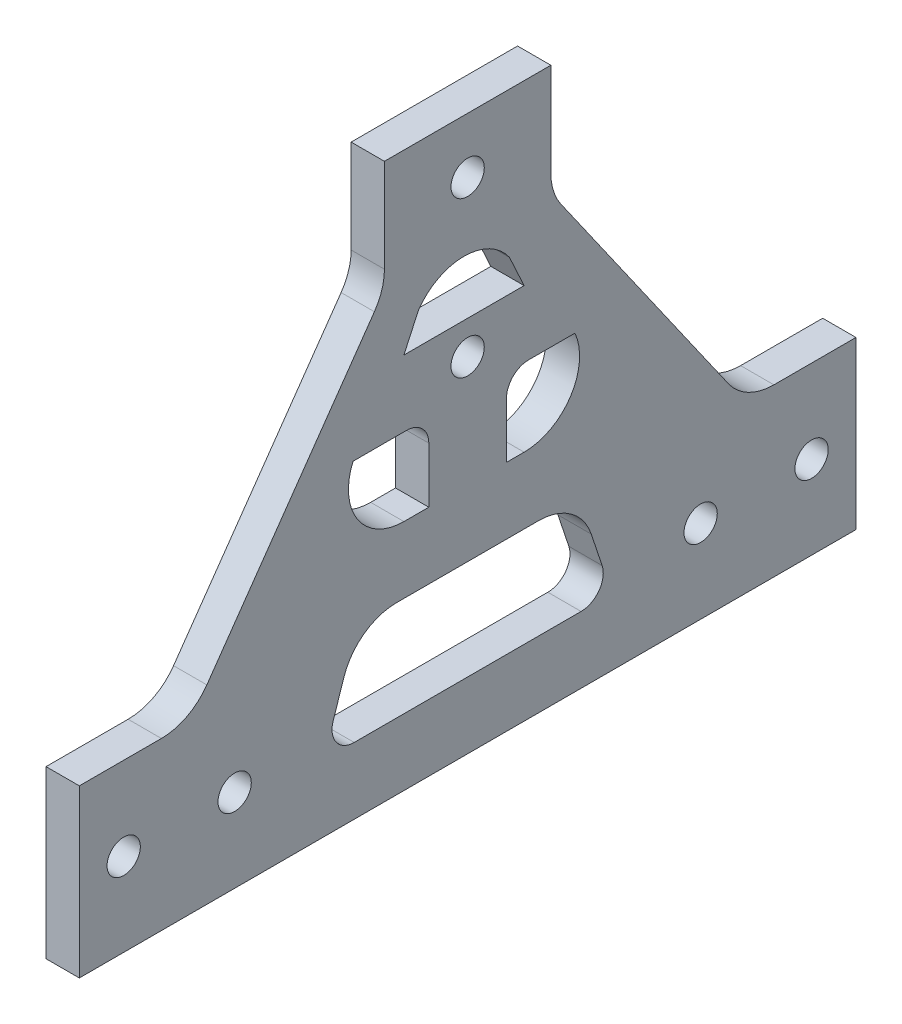
from build123d import *

# Parameters (mm, degrees)
EXTRUDE_1_DEPTH     = 3
SKETCH_3_R          = 1.5
CUT_EXTRUDE_1_DEPTH = 3


with BuildPart() as part:
    # 草图2 → 凸台-拉伸1 (new body)
    with BuildSketch(Plane(origin=(0, 0, 0), x_dir=(0, 0, -1), z_dir=(1, 0, 0))):
        with BuildLine():
            Line((0, 0), (0, -15))
            Line((0, -15), (20, -15))
            Line((20, -15), (50, -15))
            Line((50, -15), (70, -15))
            Line((70, -15), (70, 0))
            Line((70, 0), (62.603277808, 0))
            ThreePointArc((62.603277808, 0), (60.294225904, 0.565106619), (58.507118205, 2.132688278))
            Line((58.507118205, 2.132688278), (43.403840397, 23.708799432))
            ThreePointArc((43.403840397, 23.708799432), (42.731310557, 25.07291423), (42.5, 26.576111154))
            Line((42.5, 26.576111154), (42.5, 35))
            Line((42.5, 35), (27.5, 35))
            Line((27.5, 35), (27.5, 26.576111154))
            ThreePointArc((27.5, 26.576111154), (27.268689443, 25.07291423), (26.596159603, 23.708799432))
            Line((26.596159603, 23.708799432), (11.492881795, 2.132688278))
            ThreePointArc((11.492881795, 2.132688278), (9.705774096, 0.565106619), (7.396722192, 0))
            Line((7.396722192, 0), (0, 0))
        make_face()
        with BuildLine():
            Line((22.877485177, -6.367544468), (23.86037961, -3.41886117))
            ThreePointArc((23.86037961, -3.41886117), (25.680244677, -0.943789074), (28.6037961, 0))
            Line((28.6037961, 0), (41.3962039, 0))
            ThreePointArc((41.3962039, 0), (44.319755323, -0.943789074), (46.13962039, -3.41886117))
            Line((46.13962039, -3.41886117), (47.122514823, -6.367544468))
            ThreePointArc((47.122514823, -6.367544468), (46.847632597, -8.169420569), (45.225148227, -9))
            Line((45.225148227, -9), (24.774851773, -9))
            ThreePointArc((24.774851773, -9), (23.152367403, -8.169420569), (22.877485177, -6.367544468))
        make_face(mode=Mode.SUBTRACT)
        with BuildLine():
            Line((29.256242147, 6), (31.5, 6))
            Line((31.5, 6), (31.5, 11))
            ThreePointArc((31.5, 11), (30.914213562, 12.414213562), (29.5, 13))
            Line((29.5, 13), (24.673666452, 13))
            ThreePointArc((24.673666452, 13), (25.072942015, 8.261387212), (29.256242147, 6))
        make_face(mode=Mode.SUBTRACT)
        with BuildLine():
            Line((30.57750685, 21.867311722), (29.256242147, 19))
            Line((29.256242147, 19), (40.091090757, 19))
            Line((40.091090757, 19), (38.769826055, 21.867311722))
            ThreePointArc((38.769826055, 21.867311722), (34.673666452, 24), (30.57750685, 21.867311722))
        make_face(mode=Mode.SUBTRACT)
        with BuildLine():
            Line((38.5, 11), (38.5, 6))
            Line((38.5, 6), (40.091090757, 6))
            ThreePointArc((40.091090757, 6), (44.27439089, 8.261387212), (44.673666452, 13))
            Line((44.673666452, 13), (40.5, 13))
            ThreePointArc((40.5, 13), (39.085786438, 12.414213562), (38.5, 11))
        make_face(mode=Mode.SUBTRACT)
    extrude(amount=EXTRUDE_1_DEPTH)

    # 草图3 → 切除-拉伸1 (cut)
    with BuildSketch(Plane(origin=(3, 0, 0), x_dir=(0, 0, -1), z_dir=(1, 0, 0))):
        with Locations((35, 30)):
            Circle(SKETCH_3_R)
        with Locations((66, -7.5)):
            Circle(SKETCH_3_R)
        with Locations((56, -7.5)):
            Circle(SKETCH_3_R)
        with Locations((14, -7.5)):
            Circle(SKETCH_3_R)
        with Locations((4, -7.5)):
            Circle(SKETCH_3_R)
        with Locations((35, 16)):
            Circle(SKETCH_3_R)
    extrude(amount=-CUT_EXTRUDE_1_DEPTH, mode=Mode.SUBTRACT)


solid = part.part
